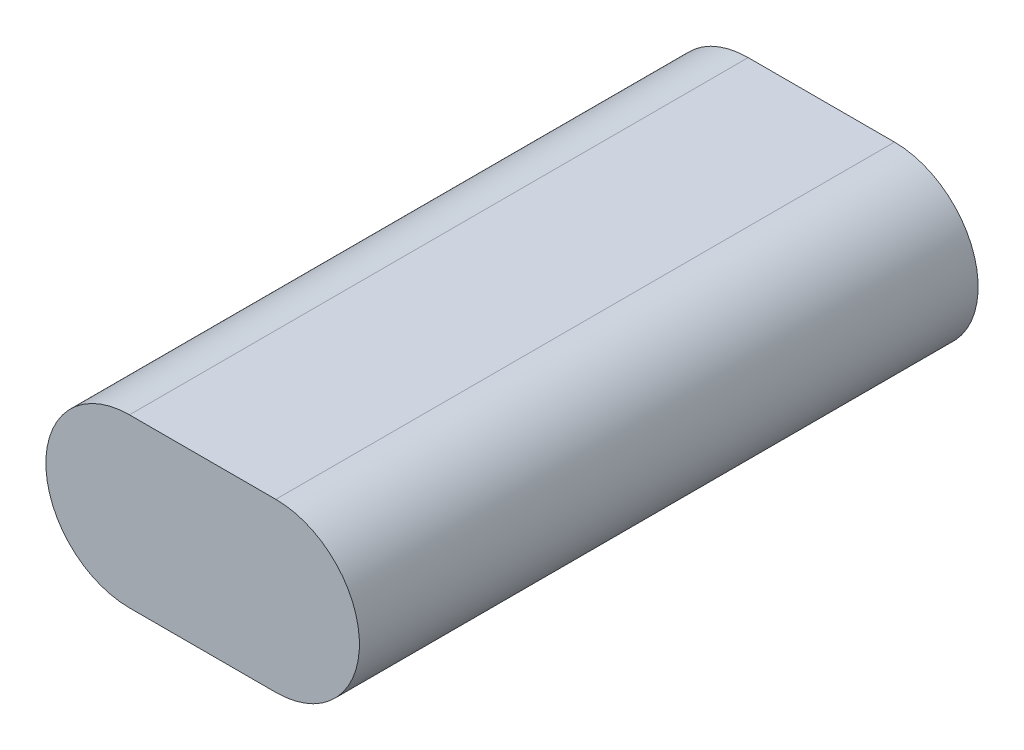
from build123d import *

# Parameters (mm, degrees)
SKETCH1_W           = 37.5
SKETCH1_H           = 74
BOSS_EXTRUDE1_DEPTH = 20
FILLET3_RADIUS      = 10
FILLET3_LENGTH      = 74
FILLET4_RADIUS      = 10
FILLET4_LENGTH      = 74


with BuildPart() as part:
    # Sketch1 → Boss-Extrude1 (new body)
    with BuildSketch(Plane(origin=(0, 0, 0), x_dir=(1, 0, 0), z_dir=(0, 1, 0))):
        Rectangle(SKETCH1_W, SKETCH1_H)
    extrude(amount=BOSS_EXTRUDE1_DEPTH)

    # Fillet3: full round fillet: the end face becomes a half cylinder, R = half its width
    fillet3_face = Plane((-18.75, 10, 0), x_dir=(0, 0, -1), z_dir=(-1, 0, 0))  # on the end face: x along it, z out of the body
    fillet3_slab = fillet3_face.offset(-FILLET3_RADIUS / 2) * Box(FILLET3_LENGTH, 2 * FILLET3_RADIUS, FILLET3_RADIUS, mode=Mode.PRIVATE)  # the body's end, R deep
    fillet3_round = Plane((-8.75, 10, 0), x_dir=(-1, 0, 0), z_dir=(0, 0, -1)) * Cylinder(FILLET3_RADIUS, FILLET3_LENGTH, mode=Mode.PRIVATE)  # its axis R under the face
    add(fillet3_slab - fillet3_round, mode=Mode.SUBTRACT)

    # Fillet4: full round fillet: the end face becomes a half cylinder, R = half its width
    fillet4_face = Plane((18.75, 10, 0), x_dir=(0, 0, 1), z_dir=(1, 0, 0))  # on the end face: x along it, z out of the body
    fillet4_slab = fillet4_face.offset(-FILLET4_RADIUS / 2) * Box(FILLET4_LENGTH, 2 * FILLET4_RADIUS, FILLET4_RADIUS, mode=Mode.PRIVATE)  # the body's end, R deep
    fillet4_round = Plane((8.75, 10, 0), x_dir=(1, 0, 0), z_dir=(0, 0, 1)) * Cylinder(FILLET4_RADIUS, FILLET4_LENGTH, mode=Mode.PRIVATE)  # its axis R under the face
    add(fillet4_slab - fillet4_round, mode=Mode.SUBTRACT)


solid = part.part
